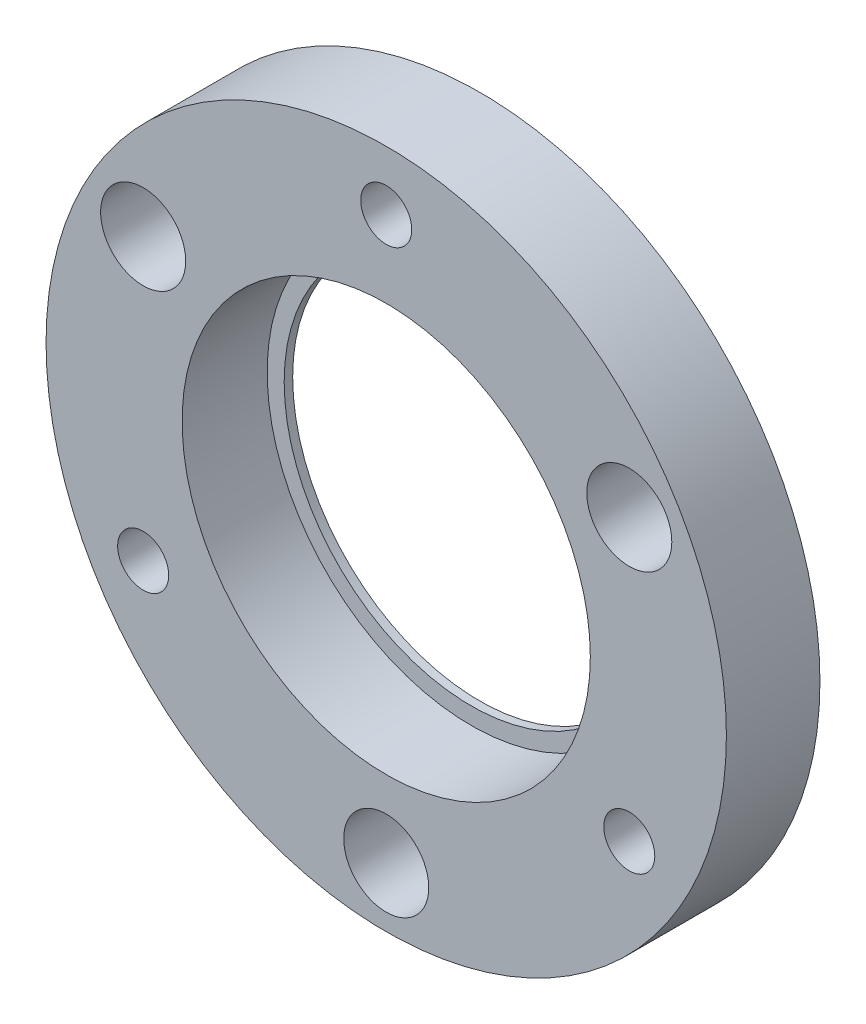
from build123d import *

# Parameters (mm, degrees)
SKETCH1_R           = 20
SKETCH1_R_2         = 1.5
SKETCH1_R_3         = 2.5
SKETCH1_R_4         = 12
BOSS_EXTRUDE1_DEPTH = 5
BOSS_EXTRUDE2_START = -0.5
SKETCH1_3_R         = 20
SKETCH1_3_R_2       = 11
SKETCH1_3_R_3       = 1.5
SKETCH1_3_R_4       = 2.5
BOSS_EXTRUDE2_DEPTH = 0.5


with BuildPart() as part:
    # Sketch1 → Boss-Extrude1 (new body)
    with BuildSketch(Plane.XY):
        Circle(SKETCH1_R)
        with Locations((-14.289419162, -8.25)):
            Circle(SKETCH1_R_2, mode=Mode.SUBTRACT)
        with Locations((0, -16.5)):
            Circle(SKETCH1_R_3, mode=Mode.SUBTRACT)
        with Locations((14.289419162, -8.25)):
            Circle(SKETCH1_R_2, mode=Mode.SUBTRACT)
        with Locations((-14.289419162, 8.25)):
            Circle(SKETCH1_R_3, mode=Mode.SUBTRACT)
        Circle(SKETCH1_R_4, mode=Mode.SUBTRACT)
        with Locations((14.289419162, 8.25)):
            Circle(SKETCH1_R_3, mode=Mode.SUBTRACT)
        with Locations((0, 16.5)):
            Circle(SKETCH1_R_2, mode=Mode.SUBTRACT)
    extrude(amount=BOSS_EXTRUDE1_DEPTH)

    # Sketch1<3> → Boss-Extrude2 (add)
    with BuildSketch(Plane.XY.offset(BOSS_EXTRUDE2_START)):
        Circle(SKETCH1_3_R)
        Circle(SKETCH1_3_R_2, mode=Mode.SUBTRACT)
        with Locations((-14.289419162, -8.25)):
            Circle(SKETCH1_3_R_3, mode=Mode.SUBTRACT)
        with Locations((0, -16.5)):
            Circle(SKETCH1_3_R_4, mode=Mode.SUBTRACT)
        with Locations((14.289419162, -8.25)):
            Circle(SKETCH1_3_R_3, mode=Mode.SUBTRACT)
        with Locations((-14.289419162, 8.25)):
            Circle(SKETCH1_3_R_4, mode=Mode.SUBTRACT)
        with Locations((0, 16.5)):
            Circle(SKETCH1_3_R_3, mode=Mode.SUBTRACT)
        with Locations((14.289419162, 8.25)):
            Circle(SKETCH1_3_R_4, mode=Mode.SUBTRACT)
    extrude(amount=BOSS_EXTRUDE2_DEPTH)


solid = part.part
